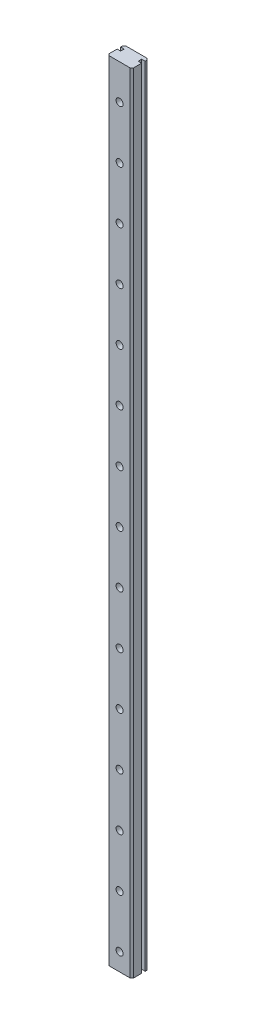
from build123d import *

# Parameters (mm, degrees)
EXTRUDE_1_DEPTH     = 225
SKETCH_2_R          = 1
CUT_EXTRUDE_1_DEPTH = 10
CHAMFER_1_SIZE      = 0.5
SKETCH_3_R          = 2.383304988
CUT_EXTRUDE_2_DEPTH = 1


with BuildPart() as part:
    # 草图1 → 凸台-拉伸1 (new body)
    with BuildSketch(Plane(origin=(0, 0, 0), x_dir=(1, 0, 0), z_dir=(0, 1, 0))):
        Polygon((-3.5, 0.4), (-3.5, -2.4), (3.5, -2.4), (3.5, 0.4), (2.5, 0.4), (2.5, 1.4), (3.5, 1.4), (3.5, 2.4), (-3.5, 2.4), (-3.5, 1.4), (-2.5, 1.4), (-2.5, 0.4), align=None)
    extrude(amount=EXTRUDE_1_DEPTH)

    # 草图2 → 切除-拉伸1 (cut)
    with BuildSketch(Plane(origin=(0, 0, -2.4), x_dir=(-1, 0, 0), z_dir=(0, 0, -1))):
        with Locations((0, 5)):
            Circle(SKETCH_2_R)
        with Locations((0, 20)):
            Circle(SKETCH_2_R)
        with Locations((0, 35)):
            Circle(SKETCH_2_R)
        with Locations((0, 50)):
            Circle(SKETCH_2_R)
        with Locations((0, 65)):
            Circle(SKETCH_2_R)
        with Locations((0, 80)):
            Circle(SKETCH_2_R)
        with Locations((0, 95)):
            Circle(SKETCH_2_R)
        with Locations((0, 110)):
            Circle(SKETCH_2_R)
        with Locations((0, 125)):
            Circle(SKETCH_2_R)
        with Locations((0, 140)):
            Circle(SKETCH_2_R)
        with Locations((0, 155)):
            Circle(SKETCH_2_R)
        with Locations((0, 170)):
            Circle(SKETCH_2_R)
        with Locations((0, 185)):
            Circle(SKETCH_2_R)
        with Locations((0, 200)):
            Circle(SKETCH_2_R)
        with Locations((0, 215)):
            Circle(SKETCH_2_R)
        with Locations((0, 230)):
            Circle(SKETCH_2_R)
    extrude(amount=-CUT_EXTRUDE_1_DEPTH, mode=Mode.SUBTRACT)

    # 倒角1
    chamfer_1_edges = [part.edges().sort_by_distance(p)[0] for p in [
        (-3.5, 112.5, -2.4),
        (3.5, 112.5, -2.4),
        (3.5, 112.5, 2.4),
        (-3.5, 112.5, 2.4),
    ]]
    chamfer(chamfer_1_edges, length=CHAMFER_1_SIZE)

    # 草图3 → 切除-拉伸2 (cut)
    with BuildSketch(Plane(origin=(0, 0, -2.4), x_dir=(-1, 0, 0), z_dir=(0, 0, -1))):
        with Locations((0, 5)):
            Circle(SKETCH_3_R)
        with Locations((0, 20)):
            Circle(SKETCH_3_R)
        with Locations((0, 35)):
            Circle(SKETCH_3_R)
        with Locations((0, 50)):
            Circle(SKETCH_3_R)
        with Locations((0, 65)):
            Circle(SKETCH_3_R)
        with Locations((0, 80)):
            Circle(SKETCH_3_R)
        with Locations((0, 95)):
            Circle(SKETCH_3_R)
        with Locations((0, 110)):
            Circle(SKETCH_3_R)
        with Locations((0, 125)):
            Circle(SKETCH_3_R)
        with Locations((0, 140)):
            Circle(SKETCH_3_R)
        with Locations((0, 155)):
            Circle(SKETCH_3_R)
        with Locations((0, 170)):
            Circle(SKETCH_3_R)
        with Locations((0, 185)):
            Circle(SKETCH_3_R)
        with Locations((0, 200)):
            Circle(SKETCH_3_R)
        with Locations((0, 215)):
            Circle(SKETCH_3_R)
        with Locations((0, 230)):
            Circle(SKETCH_3_R)
    extrude(amount=-CUT_EXTRUDE_2_DEPTH, mode=Mode.SUBTRACT)


solid = part.part
